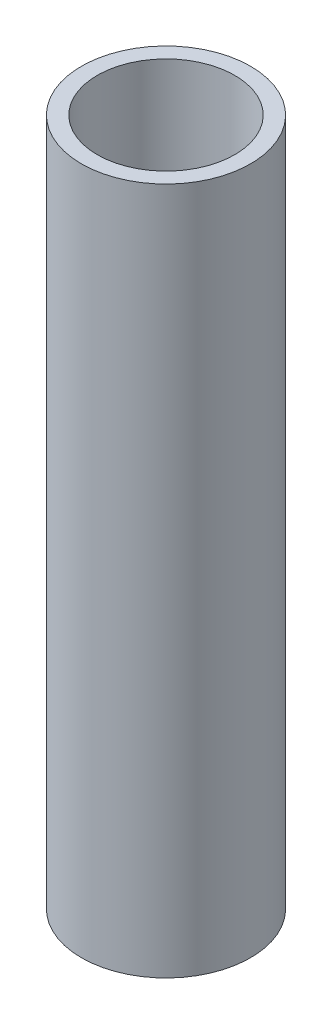
from build123d import *

# Parameters (mm, degrees)
SKETCH1_R           = 3.075
SKETCH1_R_2         = 2.5
BOSS_EXTRUDE1_DEPTH = 25


with BuildPart() as part:
    # Sketch1 → Boss-Extrude1 (new body)
    with BuildSketch(Plane(origin=(0, 0, 0), x_dir=(1, 0, 0), z_dir=(0, 1, 0))):
        with Locations(Location((0, 0, 0), (0, 0, 270))):
            Circle(SKETCH1_R)
        with Locations(Location((0, 0, 0), (0, 0, 270))):
            Circle(SKETCH1_R_2, mode=Mode.SUBTRACT)
    extrude(amount=BOSS_EXTRUDE1_DEPTH)


solid = part.part
